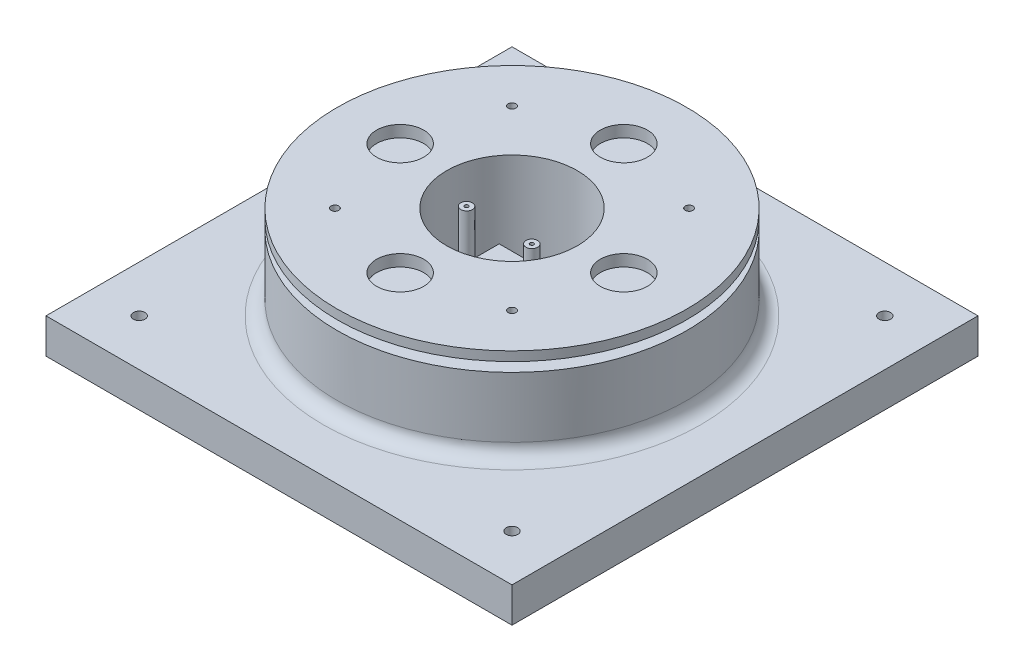
from build123d import *

# Parameters (mm, degrees)
SKETCH1_W                   = 200
SKETCH1_H                   = 200
BOSS_EXTRUDE1_DEPTH         = 15
SKETCH2_R                   = 2.5
BOSS_EXTRUDE2_DEPTH         = 31
SKETCH4_W                   = 28
SKETCH4_H                   = 28
BOSS_EXTRUDE3_DEPTH         = 10
LPATTERN2_COUNT             = 2
LPATTERN2_PITCH             = 28
FILLET1_R                   = 4
SKETCH8_R                   = 75
SKETCH8_R_2                 = 28
BOSS_EXTRUDE5_DEPTH         = 32
FILLET2_R                   = 6
SKETCH10_R                  = 67
SKETCH10_R_2                = 28
BOSS_EXTRUDE6_DEPTH         = 4
SKETCH11_R                  = 75
SKETCH11_R_2                = 28
BOSS_EXTRUDE7_DEPTH         = 4
SKETCH9_R                   = 10.1
CUT_EXTRUDE2_DEPTH          = 287.721118859
CIRPATTERN1_COUNT           = 4
SKETCH12_R                  = 10.1
BOSS_EXTRUDE8_DEPTH         = 3
CIRPATTERN2_COUNT           = 4
TAP_DRILL_FOR_M6X1_0_TAP1_D = 5
CIRPATTERN4_COUNT           = 4
CIRPATTERN5_COUNT           = 4
LPATTERN3_COUNT             = 2
LPATTERN3_PITCH             = 28


with BuildPart() as part:
    # Sketch1 → Boss-Extrude1 (new body)
    with BuildSketch(Plane(origin=(0, 0, 0), x_dir=(1, 0, 0), z_dir=(0, 1, 0))):
        with Locations((100, 100)):
            Rectangle(SKETCH1_W, SKETCH1_H)
    extrude(amount=BOSS_EXTRUDE1_DEPTH)

    # Sketch2 → Boss-Extrude2 (add)
    with BuildSketch(Plane(origin=(0, 15, 0), x_dir=(1, 0, 0), z_dir=(0, 1, 0))):
        with Locations(Location((80.5, 100, 0), (0, 0, 90))):
            Circle(SKETCH2_R)
    boss_extrude2 = extrude(amount=BOSS_EXTRUDE2_DEPTH)

    # Sketch4 → Boss-Extrude3 (add)
    with BuildSketch(Plane(origin=(0, 15, 0), x_dir=(1, 0, 0), z_dir=(0, 1, 0))):
        with Locations((94.5, 100)):
            Rectangle(SKETCH4_W, SKETCH4_H)
    extrude(amount=BOSS_EXTRUDE3_DEPTH)

    # LPattern2: Boss-Extrude2 ×2
    with Locations(*[(i * LPATTERN2_PITCH, 0, 0) for i in range(1, LPATTERN2_COUNT)]):
        add(boss_extrude2)

    # Fillet1
    fillet1_edges = [part.edges().sort_by_distance(p)[0] for p in [
        (78, 15, -100),
        (80.5, 15, -91.75),
        (80.5, 15, -108.25),
        (94.5, 15, -86),
        (108.5, 15, -91.75),
        (94.5, 15, -114),
        (108.5, 15, -108.25),
        (111, 15, -100),
    ]]
    fillet(fillet1_edges, radius=FILLET1_R)

    # Sketch8 → Boss-Extrude5 (add)
    with BuildSketch(Plane(origin=(0, 15, 0), x_dir=(1, 0, 0), z_dir=(0, 1, 0))):
        with Locations(Location((100, 100, 0), (0, 0, 90))):
            Circle(SKETCH8_R)
        with Locations(Location((100, 100, 0), (0, 0, 139.994799115))):
            Circle(SKETCH8_R_2, mode=Mode.SUBTRACT)
    extrude(amount=BOSS_EXTRUDE5_DEPTH)

    # Fillet2
    fillet2_edges = [part.edges().sort_by_distance(p)[0] for p in [
        (100, 15, -25),
    ]]
    fillet(fillet2_edges, radius=FILLET2_R)

    # Sketch10 → Boss-Extrude6 (add)
    with BuildSketch(Plane(origin=(0, 47, 0), x_dir=(1, 0, 0), z_dir=(0, 1, 0))):
        with Locations(Location((100, 100, 0), (0, 0, 270))):
            Circle(SKETCH10_R)
        with Locations(Location((100, 100, 0), (0, 0, 139.994799115))):
            Circle(SKETCH10_R_2, mode=Mode.SUBTRACT)
    extrude(amount=BOSS_EXTRUDE6_DEPTH)

    # Sketch11 → Boss-Extrude7 (add)
    with BuildSketch(Plane(origin=(0, 51, 0), x_dir=(1, 0, 0), z_dir=(0, 1, 0))):
        with Locations(Location((100, 100, 0), (0, 0, 90))):
            Circle(SKETCH11_R)
        with Locations(Location((100, 100, 0), (0, 0, 139.994799115))):
            Circle(SKETCH11_R_2, mode=Mode.SUBTRACT)
    extrude(amount=BOSS_EXTRUDE7_DEPTH)

    # Sketch9 → Cut-Extrude2 (cut, through all)
    with BuildSketch(Plane(origin=(0, 47, 0), x_dir=(1, 0, 0), z_dir=(0, 1, 0))):
        with Locations(Location((100, 148, 0), (0, 0, 270))):
            Circle(SKETCH9_R)
    cut_extrude2 = extrude(amount=CUT_EXTRUDE2_DEPTH, mode=Mode.SUBTRACT)

    # CirPattern1: Cut-Extrude2 ×4 about axis
    cirpattern1_axis = Axis((100, 0, -100), (0, 1, 0))
    for i in range(1, CIRPATTERN1_COUNT):
        add(cut_extrude2.rotate(cirpattern1_axis, i * 360 / CIRPATTERN1_COUNT), mode=Mode.SUBTRACT)

    # Sketch12 → Boss-Extrude8 (add)
    with BuildSketch(Plane(origin=(0, 47, 0), x_dir=(1, 0, 0), z_dir=(0, 1, 0))):
        with Locations(Location((100, 148, 0), (0, 0, 270))):
            Circle(SKETCH12_R)
    boss_extrude8 = extrude(amount=BOSS_EXTRUDE8_DEPTH)

    # CirPattern2: Boss-Extrude8 ×4 about axis
    cirpattern2_axis = Axis((100, 0, -100), (0, -1, 0))
    for i in range(1, CIRPATTERN2_COUNT):
        add(boss_extrude8.rotate(cirpattern2_axis, i * 360 / CIRPATTERN2_COUNT))

    # Tap Drill for M6x1.0 Tap1 (through all)
    with Locations(Plane(origin=(0, 15, 0), x_dir=(1, 0, 0), z_dir=(0, 1, 0))):
        with Locations((20, 20)):
            tap_drill_for_m6x1_0_tap1 = Hole(TAP_DRILL_FOR_M6X1_0_TAP1_D / 2)

    # CirPattern4: Tap Drill for M6x1.0 Tap1 ×4 about axis
    cirpattern4_axis = Axis((100, 0, -100), (0, 1, 0))
    for i in range(1, CIRPATTERN4_COUNT):
        add(tap_drill_for_m6x1_0_tap1.rotate(cirpattern4_axis, i * 360 / CIRPATTERN4_COUNT), mode=Mode.SUBTRACT)

    # Sketch23 → Tap Drill for M4x0.7 Tap2 (revolve, cut)
    with BuildSketch(Plane(origin=(138, 55, -138), x_dir=(0, 0, 1), z_dir=(1, 0, 0))):
        Polygon((0, 0), (0, 20.991420021), (1.65, 20), (1.65, 0), align=None)
    tap_drill_for_m4x0_7_tap2 = revolve(axis=Axis((138, 61.35, -138), (0, -1, 0)), mode=Mode.SUBTRACT)

    # CirPattern5: Tap Drill for M4x0.7 Tap2 ×4 about axis
    cirpattern5_axis = Axis((100, 0, -100), (0, 1, 0))
    for i in range(1, CIRPATTERN5_COUNT):
        add(tap_drill_for_m4x0_7_tap2.rotate(cirpattern5_axis, i * 360 / CIRPATTERN5_COUNT), mode=Mode.SUBTRACT)

    # Sketch28 → Tap Drill for M2x0.4 Tap1 (revolve, cut)
    with BuildSketch(Plane(origin=(80.5, 46, -100), x_dir=(0, 0, 1), z_dir=(1, 0, 0))):
        Polygon((0, 0), (0, 10.480688495), (0.8, 10), (0.8, 0), align=None)
    tap_drill_for_m2x0_4_tap1 = revolve(axis=Axis((80.5, 52.35, -100), (0, -1, 0)), mode=Mode.SUBTRACT)

    # LPattern3: Tap Drill for M2x0.4 Tap1 ×2
    with Locations(*[(i * LPATTERN3_PITCH, 0, 0) for i in range(1, LPATTERN3_COUNT)]):
        add(tap_drill_for_m2x0_4_tap1, mode=Mode.SUBTRACT)


solid = part.part
